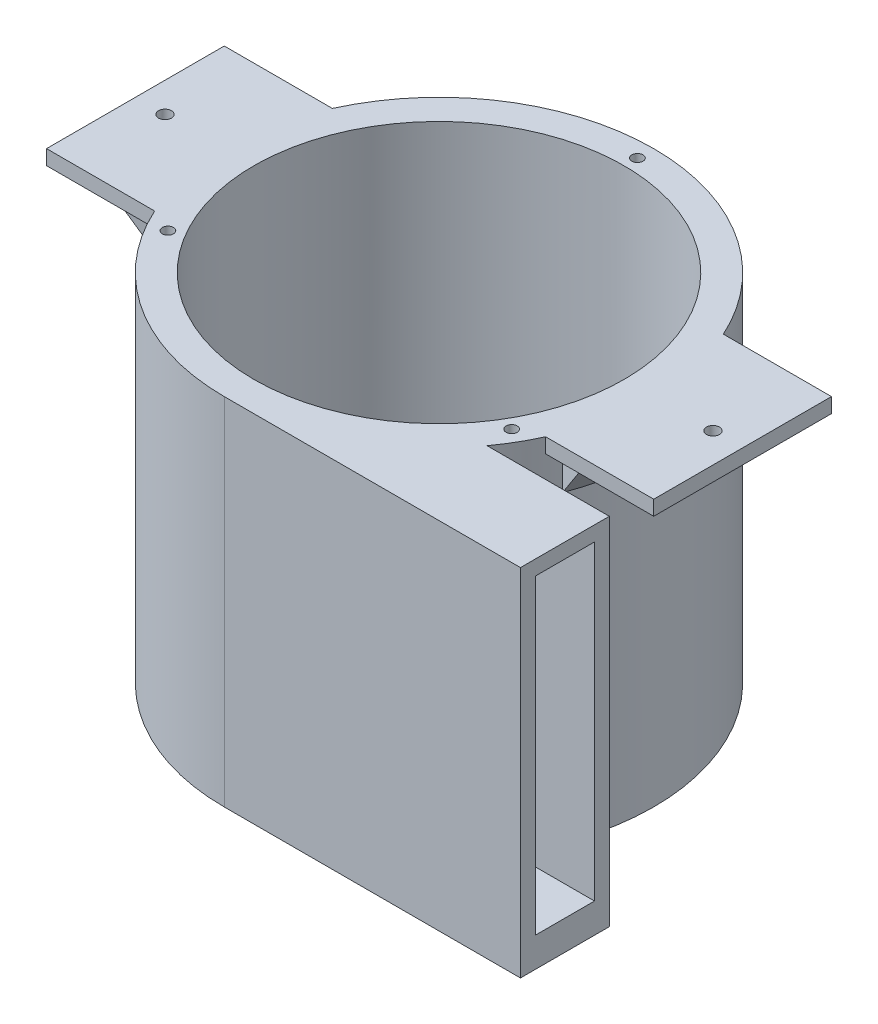
from build123d import *

# Parameters (mm, degrees)
SKETCH1_R                = 92.075
SKETCH1_R_2              = 79.375
BOSS_EXTRUDE1_DEPTH      = 69.85
SKETCH2_R                = 92.075
BOSS_EXTRUDE2_DEPTH      = 12.7
SKETCH3_R                = 8.73125
CUT_EXTRUDE1_DEPTH       = 12.7
SKETCH4_R                = 2.38125
CUT_EXTRUDE2_DEPTH       = 19.05
BOSS_EXTRUDE3_START      = -12.7
BOSS_EXTRUDE3_DEPTH      = 12.7
SKETCH7_W                = 127
SKETCH7_H                = 38.1
CUT_EXTRUDE4_DEPTH       = 139.7
SKETCH8_W                = 127
SKETCH8_H                = 6.35
BOSS_EXTRUDE4_DEPTH      = 139.7
BOSS_EXTRUDE5_DEPTH      = 139.7
BOSS_EXTRUDE6_START      = -6.35
BOSS_EXTRUDE6_DEPTH      = 6.35
BOSS_EXTRUDE7_DEPTH      = 6.35
REVOLVE1_ANGLE           = 21
REVOLVE1_OTHER_WAY_ANGLE = 21
SKETCH14_R               = 2.778125
CUT_EXTRUDE5_DEPTH       = 9.525


with BuildPart() as part:
    # Sketch1 → Boss-Extrude1 (new, symmetric)
    with BuildSketch(Plane(origin=(0, 0, 0), x_dir=(1, 0, 0), z_dir=(0, 1, 0))):
        with Locations(Location((0, 0, 0), (0, 0, 270))):
            Circle(SKETCH1_R)
        with Locations(Location((0, 0, 0), (0, 0, 270))):
            Circle(SKETCH1_R_2, mode=Mode.SUBTRACT)
    extrude(amount=BOSS_EXTRUDE1_DEPTH, both=True)

    # Sketch2 → Boss-Extrude2 (add)
    with BuildSketch(Plane.XZ.offset(69.85)):
        with Locations(Location((0, 0, 0), (0, 0, 270))):
            Circle(SKETCH2_R)
    extrude(amount=BOSS_EXTRUDE2_DEPTH)

    # Sketch3 → Cut-Extrude1 (cut)
    with BuildSketch(Plane.XZ.offset(82.55)):
        with Locations(Location((0, 0, 0), (0, 0, 270))):
            Circle(SKETCH3_R)
    extrude(amount=-CUT_EXTRUDE1_DEPTH, mode=Mode.SUBTRACT)

    # Sketch4 → Cut-Extrude2 (cut)
    with BuildSketch(Plane(origin=(0, 69.85, 0), x_dir=(1, 0, 0), z_dir=(0, 1, 0))):
        with Locations(Location((0, 85.09, 0), (0, 0, 270))):
            Circle(SKETCH4_R)
        with Locations(Location((73.690101608, -42.545, 0), (0, 0, 270))):
            Circle(SKETCH4_R)
        with Locations(Location((-73.690101608, -42.545, 0), (0, 0, 270))):
            Circle(SKETCH4_R)
    extrude(amount=-CUT_EXTRUDE2_DEPTH, mode=Mode.SUBTRACT)

    # Sketch6 → Boss-Extrude3 (add)
    with BuildSketch(Plane.XZ.offset(82.55).offset(BOSS_EXTRUDE3_START)):
        with BuildLine():
            Line((127, 92.075), (0, 92.075))
            ThreePointArc((0, 92.075), (41.881126418, 81.99863947), (74.59560979, 53.975))
            Line((74.59560979, 53.975), (127, 53.975))
            Line((127, 53.975), (127, 92.075))
        make_face()
    extrude(amount=BOSS_EXTRUDE3_DEPTH)

    # Sketch7 → Cut-Extrude4 (cut)
    with BuildSketch(Plane(origin=(0, 69.85, 0), x_dir=(1, 0, 0), z_dir=(0, 1, 0))):
        with Locations((63.5, -73.025)):
            Rectangle(SKETCH7_W, SKETCH7_H)
    extrude(amount=-CUT_EXTRUDE4_DEPTH, mode=Mode.SUBTRACT)

    # Sketch8 → Boss-Extrude4 (add)
    with BuildSketch(Plane(origin=(0, -69.85, 0), x_dir=(1, 0, 0), z_dir=(0, 1, 0))):
        with Locations((63.5, -88.9)):
            Rectangle(SKETCH8_W, SKETCH8_H)
    extrude(amount=BOSS_EXTRUDE4_DEPTH)

    # Sketch9 → Boss-Extrude5 (add)
    with BuildSketch(Plane(origin=(0, -69.85, 0), x_dir=(1, 0, 0), z_dir=(0, 1, 0))):
        with BuildLine():
            Line((127, -53.975), (58.198711326, -53.975))
            ThreePointArc((58.198711326, -53.975), (54.984921313, -57.245515573), (51.587643869, -60.325))
            Line((51.587643869, -60.325), (127, -60.325))
            Line((127, -60.325), (127, -53.975))
        make_face()
    extrude(amount=BOSS_EXTRUDE5_DEPTH)

    # Sketch10 → Boss-Extrude6 (add)
    with BuildSketch(Plane(origin=(0, 69.85, 0), x_dir=(1, 0, 0), z_dir=(0, 1, 0)).offset(BOSS_EXTRUDE6_START)):
        with BuildLine():
            ThreePointArc((0, -79.375), (27.49630657, -74.460350187), (51.587643869, -60.325))
            Line((51.587643869, -60.325), (127, -60.325))
            Line((127, -60.325), (127, -85.725))
            Line((127, -85.725), (0, -85.725))
            Line((0, -85.725), (0, -79.375))
        make_face()
    extrude(amount=BOSS_EXTRUDE6_DEPTH)

    # Sketch11 → Boss-Extrude7 (add)
    with BuildSketch(Plane(origin=(0, 69.85, 0), x_dir=(1, 0, 0), z_dir=(0, 1, 0))):
        with BuildLine():
            ThreePointArc((-83.822405269, -38.1), (-92.075, 0), (-83.822405269, 38.1))
            Line((-83.822405269, 38.1), (-130.175, 38.1))
            Line((-130.175, 38.1), (-130.175, -38.1))
            Line((-130.175, -38.1), (-83.822405269, -38.1))
        make_face()
        with BuildLine():
            Line((83.822405269, -38.1), (130.175, -38.1))
            Line((130.175, -38.1), (130.175, 38.1))
            Line((130.175, 38.1), (83.822405269, 38.1))
            ThreePointArc((83.822405269, 38.1), (92.075, 0), (83.822405269, -38.1))
        make_face()
    extrude(amount=-BOSS_EXTRUDE7_DEPTH)

    # Sketch13 → Revolve1 (revolve)
    with BuildSketch(Plane.XY):
        Polygon((92.075, 63.5), (92.075, 47.625), (104.775, 63.5), align=None)
        Polygon((-92.075, 63.5), (-92.075, 47.625), (-104.775, 63.5), align=None)
    revolve(axis=Axis((0, -102.398385613, 0), (0, 1, 0)), revolution_arc=REVOLVE1_ANGLE)

    # Sketch13 → Revolve1 other way (revolve)
    with BuildSketch(Plane.XY):
        Polygon((92.075, 63.5), (92.075, 47.625), (104.775, 63.5), align=None)
        Polygon((-92.075, 63.5), (-92.075, 47.625), (-104.775, 63.5), align=None)
    revolve(axis=Axis((0, -102.398385613, 0), (0, -1, 0)), revolution_arc=REVOLVE1_OTHER_WAY_ANGLE)

    # Sketch14 → Cut-Extrude5 (cut)
    with BuildSketch(Plane(origin=(0, 69.85, 0), x_dir=(1, 0, 0), z_dir=(0, 1, 0))):
        with Locations(Location((-117.475, 0, 0), (0, 0, 180))):
            Circle(SKETCH14_R)
        with Locations(Location((117.475, 0, 0), (0, 0, 180))):
            Circle(SKETCH14_R)
    extrude(amount=-CUT_EXTRUDE5_DEPTH, mode=Mode.SUBTRACT)


solid = part.part
